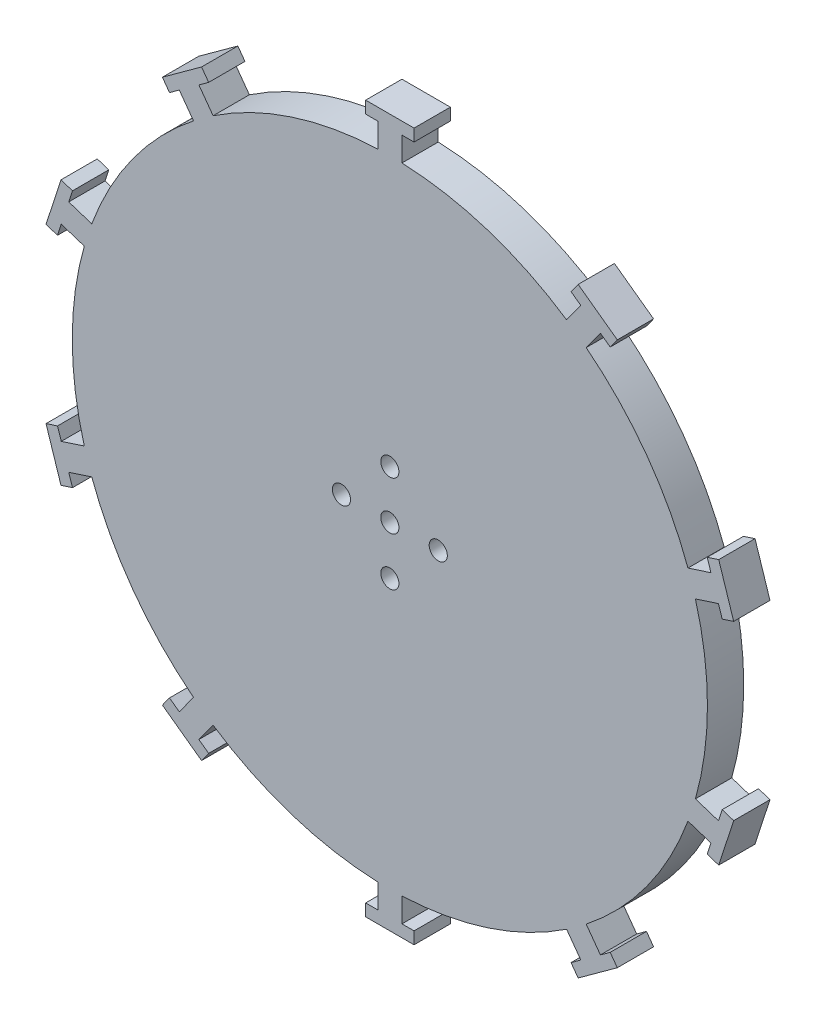
from build123d import *
from build123d.topology import SkipClean

# Parameters (mm, degrees)
SKETCH1_R           = 52.5
BOSS_EXTRUDE1_DEPTH = 2
BOSS_EXTRUDE2_DEPTH = 6
CIRPATTERN1_COUNT   = 10
SKETCH4_R           = 1.5
CUT_EXTRUDE2_DEPTH  = 10


with BuildPart() as part:
    # Sketch1 → Boss-Extrude1 (new body)
    with BuildSketch(Plane.XY):
        Circle(SKETCH1_R)
    extrude(amount=BOSS_EXTRUDE1_DEPTH)

    # Sketch6 → Boss-Extrude2 (add)
    with SkipClean():  # the faces are left unmerged after this step: merging them gives an invalid solid
        with BuildSketch(Plane.XY):
            with BuildLine():
                Line((-2, 52.46189093), (-2, 56.46189093))
                Line((-2, 56.46189093), (-4, 56.46189093))
                Line((-4, 56.46189093), (-4, 58.46189093))
                Line((-4, 58.46189093), (4, 58.46189093))
                Line((4, 58.46189093), (4, 56.46189093))
                Line((4, 56.46189093), (2, 56.46189093))
                Line((2, 56.46189093), (2, 52.46189093))
                ThreePointArc((2, 52.46189093), (0, -52.5), (-2, 52.46189093))
            make_face()
        boss_extrude2 = extrude(amount=BOSS_EXTRUDE2_DEPTH)

    # CirPattern1: Boss-Extrude2 ×10 about axis
    cirpattern1_axis = Axis((0, 0, 0), (0, 0, 1))
    for i in range(1, CIRPATTERN1_COUNT):
        add(boss_extrude2.rotate(cirpattern1_axis, i * 360 / CIRPATTERN1_COUNT))

    # Sketch4 → Cut-Extrude2 (cut, symmetric)
    with BuildSketch(Plane.XY.offset(6)):
        with Locations((0, 8)):
            Circle(SKETCH4_R)
        Circle(SKETCH4_R)
        with Locations((8, 0)):
            Circle(SKETCH4_R)
        with Locations((0, -8)):
            Circle(SKETCH4_R)
        with Locations((-8, 0)):
            Circle(SKETCH4_R)
    extrude(amount=CUT_EXTRUDE2_DEPTH, both=True, mode=Mode.SUBTRACT)


solid = part.part
